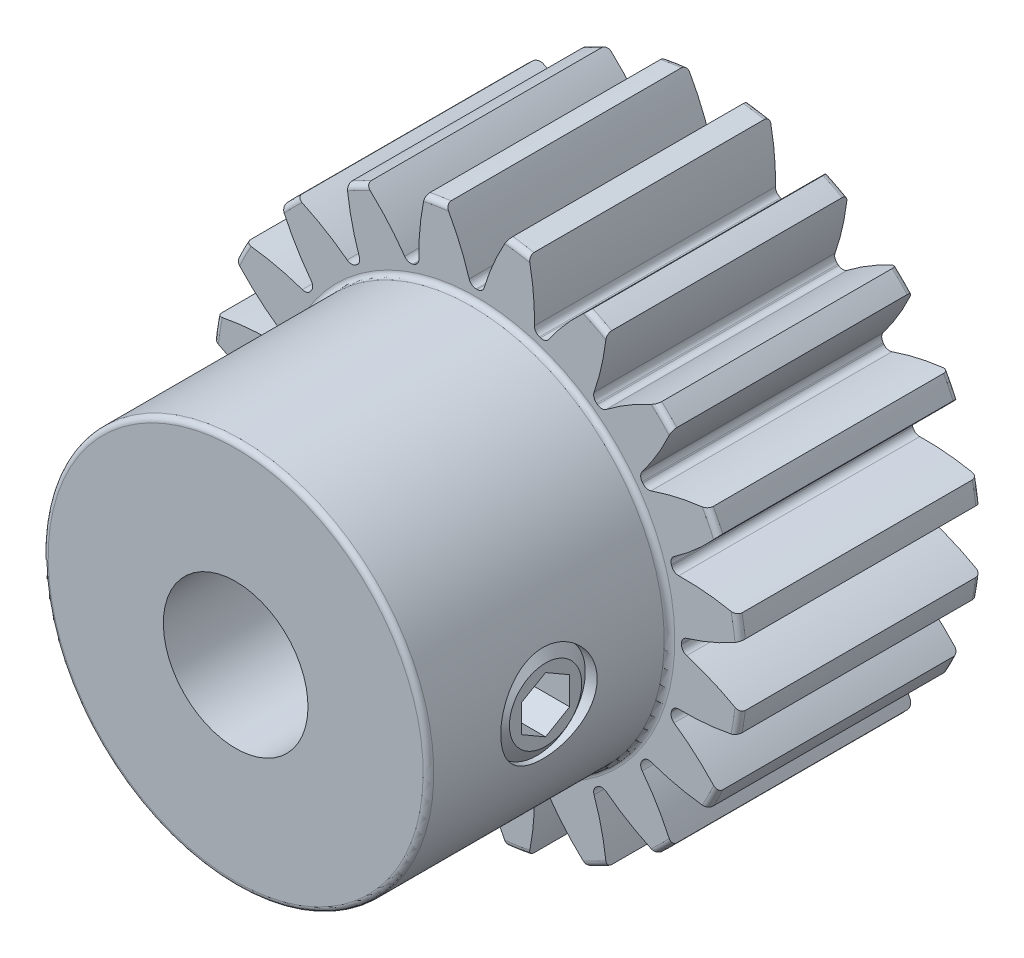
from build123d import *

# Parameters (mm, degrees)
FILLET2_R               = 0.22
CUT_EXTRUDE2_DEPTH      = 19.493242182
CIRPATTERN1_COUNT       = 20
CUT_EXTRUDE3_REACH      = 31.623
CUT_EXTRUDE3_END_RADIUS = 3
SKETCH11_R              = 2
CUT_EXTRUDE5_DEPTH      = 1.5


with BuildPart() as part:
    # Sketch4 → Revolve1 (revolve)
    with BuildSketch(Plane(origin=(0, 0, 0), x_dir=(0, 0, -1), z_dir=(1, 0, 0))):
        Polygon((-20, 3), (-20, 8), (-10, 8), (-10, 11), (0, 11), (0, 3), align=None)
    revolve(axis=Axis((0, 0, 10), (0, 0, 1)))

    # Fillet2
    fillet2_edges = [part.edges().sort_by_distance(p)[0] for p in [
        (0, -11, 0),
        (0, -11, 10),
        (0, -8, 10),
        (0, -8, 20),
    ]]
    fillet(fillet2_edges, radius=FILLET2_R)

    # Sketch7 → Cut-Extrude2 (cut, through all)
    with BuildSketch(Plane.XY.offset(10)):
        with BuildLine():
            ThreePointArc((-0.023188573, 8.49996837), (0, 8.5), (0.023188573, 8.49996837))
            ThreePointArc((0.023188573, 8.49996837), (0.202550102, 8.558876081), (0.311217537, 8.713252456))
            ThreePointArc((0.311217537, 8.713252456), (0.730563567, 9.848515279), (1.283980466, 10.924806367))
            ThreePointArc((1.283980466, 10.924806367), (0, 11), (-1.283980466, 10.924806367))
            ThreePointArc((-1.283980466, 10.924806367), (-0.730563567, 9.848515279), (-0.311217537, 8.713252456))
            ThreePointArc((-0.311217537, 8.713252456), (-0.202550102, 8.558876081), (-0.023188573, 8.49996837))
        make_face()
    cut_extrude2 = extrude(amount=-CUT_EXTRUDE2_DEPTH, mode=Mode.SUBTRACT)

    # CirPattern1: Cut-Extrude2 ×20 about axis
    cirpattern1_axis = Axis((0, 0, 0), (0, 0, 1))
    for i in range(1, CIRPATTERN1_COUNT):
        add(cut_extrude2.rotate(cirpattern1_axis, i * 360 / CIRPATTERN1_COUNT), mode=Mode.SUBTRACT)

    # Cut-Extrude3: up to this cylinder (the profile starts outside it)
    cut_extrude3_end = Plane(origin=(0, 0, 15), z_dir=(0, 0, -1)) * Cylinder(CUT_EXTRUDE3_END_RADIUS, 70.246, mode=Mode.PRIVATE)
    # Sketch11 → Cut-Extrude3 (cut, up to the surface)
    with BuildSketch(Plane(origin=(8, 0, 0), x_dir=(0, 0, -1), z_dir=(1, 0, 0)), mode=Mode.PRIVATE) as cut_extrude3_sk1:
        with Locations((-15, 0)):
            Circle(SKETCH11_R)
    cut_extrude3_tool1 = extrude(cut_extrude3_sk1.sketch, amount=-CUT_EXTRUDE3_REACH, mode=Mode.PRIVATE) - cut_extrude3_end
    add(cut_extrude3_tool1.solids().sort_by_distance((8, 0, 15))[0], mode=Mode.SUBTRACT)


with BuildPart() as body_2:
    # Sketch13 → Revolve2 (revolve)
    with BuildSketch(Plane.XY.offset(15), mode=Mode.PRIVATE) as revolve2_sk:
        Polygon((7.858116826, 0), (4.516617891, 0), (3.858116826, 1.095929813), (4.762187013, 2), (7.508013045, 2), (7.858116826, 1.499999984), align=None)
    revolve(revolve2_sk.sketch.rotate(Axis((-7.858116826, 0, 15), (1, 0, 0)), 90), axis=Axis((-7.858116826, 0, 15), (1, 0, 0)))

    # Sketch14 → Cut-Extrude5 (cut)
    with BuildSketch(Plane.ZY.offset(-7.858116826)):
        Polygon((14, -0.577350269), (14, 0.577350269), (15, 1.154700538), (16, 0.577350269), (16, -0.577350269), (15, -1.154700538), align=None)
    extrude(amount=CUT_EXTRUDE5_DEPTH, mode=Mode.SUBTRACT)


solid = Compound([part.part, body_2.part])
